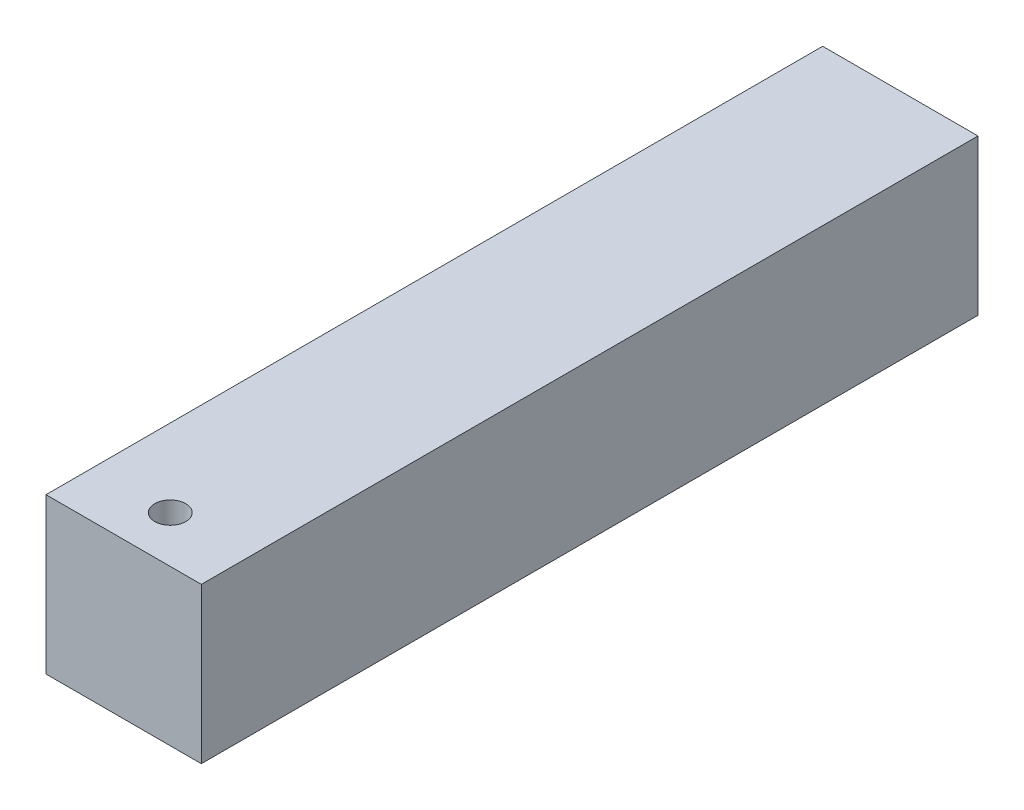
from build123d import *

# Parameters (mm, degrees)
SKETCH1_W           = 10
SKETCH1_H           = 10
BOSS_EXTRUDE1_DEPTH = 50
SKETCH2_R           = 1
CUT_EXTRUDE1_DEPTH  = 50


with BuildPart() as part:
    # Sketch1 → Boss-Extrude1 (new body)
    with BuildSketch(Plane.XY):
        with Locations((5, -5)):
            Rectangle(SKETCH1_W, SKETCH1_H)
    extrude(amount=BOSS_EXTRUDE1_DEPTH)

    # Sketch2 → Cut-Extrude1 (cut)
    with BuildSketch(Plane(origin=(0, -10, 0), x_dir=(-1, 0, 0), z_dir=(0, -1, 0))):
        with Locations(Location((-5, -47, 0), (0, 0, 90))):
            Circle(SKETCH2_R)
    extrude(amount=-CUT_EXTRUDE1_DEPTH, mode=Mode.SUBTRACT)


solid = part.part
